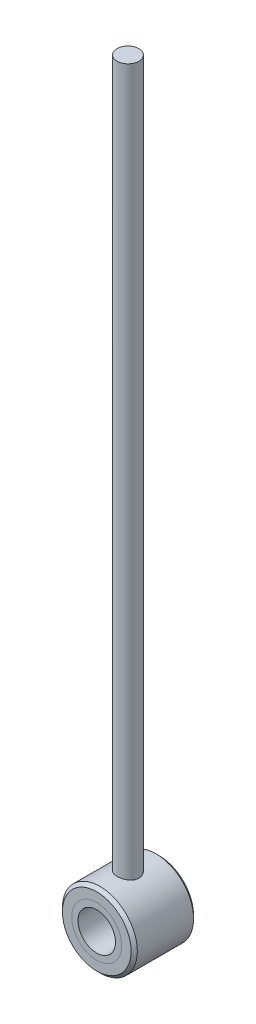
from build123d import *

# Parameters (mm, degrees)
BOSS_EXTRUDE1_DEPTH      = 56
BOSS_EXTRUDE1_DEPTH_BACK = 58
SKETCH1_R                = 3
SKETCH2_R                = 6
SKETCH2_R_2              = 4
BOSS_EXTRUDE2_DEPTH      = 5
SKETCH3_R                = 4
SKETCH3_R_2              = 3
BOSS_EXTRUDE3_DEPTH      = 5
CHAMFER2_SIZE            = 0.5
SKETCH4_OUTSIDE_W        = 39.194
SKETCH4_OUTSIDE_H        = 37.194
SKETCH4_OUTSIDE_R        = 1.75
CUT_EXTRUDE4_DEPTH       = 114


with BuildPart() as part:
    # Sketch1 → Boss-Extrude1 (new, two sides: drawn at the far end of the back side and taken through both)
    with BuildSketch(Plane(origin=(0, 0, 0), x_dir=(1, 0, 0), z_dir=(0, 1, 0)).offset(-BOSS_EXTRUDE1_DEPTH_BACK)):
        with Locations(Location((0, 0, 0), (0, 0, 270))):
            Circle(SKETCH1_R)
    extrude(amount=BOSS_EXTRUDE1_DEPTH + BOSS_EXTRUDE1_DEPTH_BACK)

    # Sketch4 outside → Cut-Extrude4 (cut)
    with BuildSketch(Plane(origin=(0, 56, 0), x_dir=(1, 0, 0), z_dir=(0, 1, 0))):
        Rectangle(SKETCH4_OUTSIDE_W, SKETCH4_OUTSIDE_H)
        with Locations(Location((0, 0, 0), (0, 0, 270))):
            Circle(SKETCH4_OUTSIDE_R, mode=Mode.SUBTRACT)
    extrude(amount=-CUT_EXTRUDE4_DEPTH, mode=Mode.SUBTRACT)


with BuildPart() as body_2:
    # Sketch2 → Boss-Extrude2 (new, symmetric)
    with BuildSketch(Plane.XY):
        with Locations((0, -63)):
            Circle(SKETCH2_R)
        with Locations((0, -63)):
            Circle(SKETCH2_R_2, mode=Mode.SUBTRACT)
    extrude(amount=BOSS_EXTRUDE2_DEPTH, both=True)

    # Chamfer2
    chamfer2_edges = [body_2.edges().sort_by_distance(p)[0] for p in [
        (-6, -63, -5),
        (-6, -63, 5),
    ]]
    chamfer(chamfer2_edges, length=CHAMFER2_SIZE)


with BuildPart() as body_3:
    # Sketch3 → Boss-Extrude3 (new, symmetric)
    with BuildSketch(Plane.XY):
        with Locations((0, -63)):
            Circle(SKETCH3_R)
        with Locations((0, -63)):
            Circle(SKETCH3_R_2, mode=Mode.SUBTRACT)
    extrude(amount=BOSS_EXTRUDE3_DEPTH, both=True)


with BuildPart() as part_1:
    add(part.part)

    # Combine1: union body 2
    add(body_2.part)


solid = Compound([body_3.part, part_1.part])
